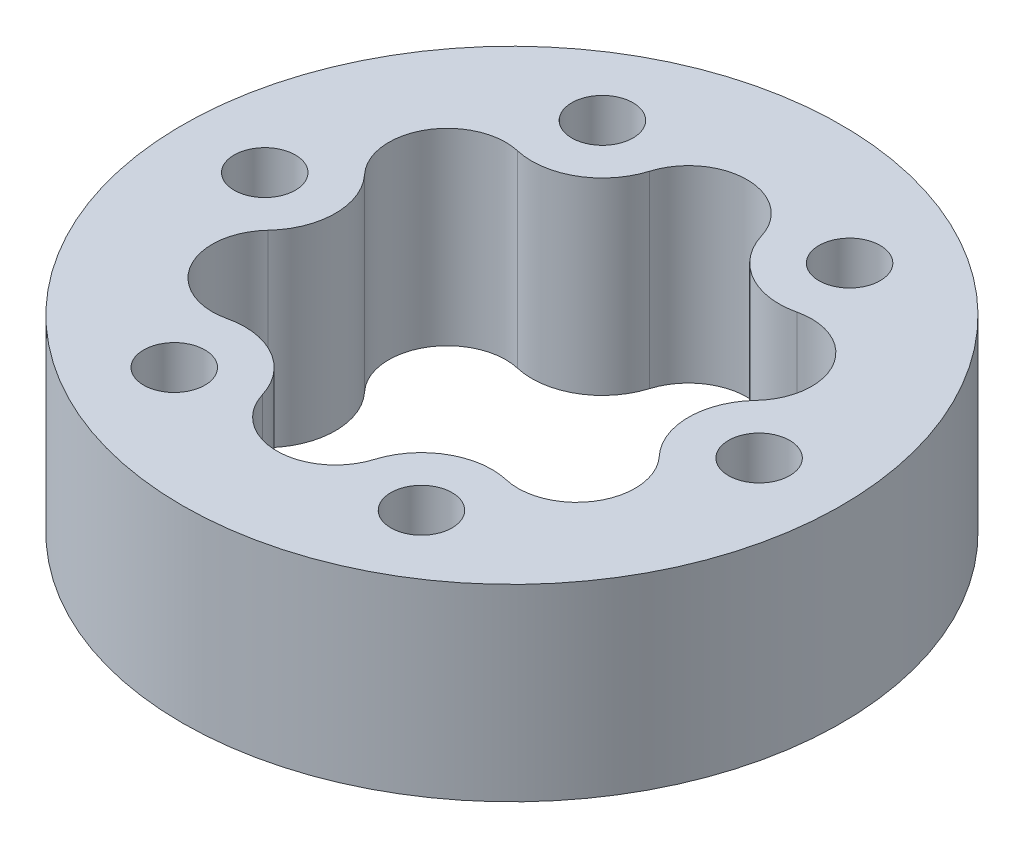
from build123d import *

# Parameters (mm, degrees)
SKETCH_1_R               = 28
SKETCH_1_R_2             = 2.6
EXTRUDE_1_DEPTH          = 16
CUT_EXTRUDE_2_DEPTH      = 43.708313008
CUT_EXTRUDE_2_DEPTH_BACK = 43.708313008


with BuildPart() as part:
    # 草图1 → 凸台-拉伸1 (new body)
    with BuildSketch(Plane(origin=(0, 0, 0), x_dir=(1, 0, 0), z_dir=(0, 1, 0))):
        with Locations(Location((0, 0, 0), (0, 0, 270))):
            Circle(SKETCH_1_R)
        with Locations(Location((10.5, 18.186533479, 0), (0, 0, 270))):
            Circle(SKETCH_1_R_2, mode=Mode.SUBTRACT)
        with Locations(Location((21, 0, 0), (0, 0, 270))):
            Circle(SKETCH_1_R_2, mode=Mode.SUBTRACT)
        with Locations(Location((10.5, -18.186533479, 0), (0, 0, 270))):
            Circle(SKETCH_1_R_2, mode=Mode.SUBTRACT)
        with Locations(Location((-10.5, -18.186533479, 0), (0, 0, 270))):
            Circle(SKETCH_1_R_2, mode=Mode.SUBTRACT)
        with Locations(Location((-21, 0, 0), (0, 0, 270))):
            Circle(SKETCH_1_R_2, mode=Mode.SUBTRACT)
        with Locations(Location((-10.5, 18.186533479, 0), (0, 0, 270))):
            Circle(SKETCH_1_R_2, mode=Mode.SUBTRACT)
    extrude(amount=EXTRUDE_1_DEPTH)

    # 草图4 → 切除-拉伸2 (cut, two sides: drawn at the far end of the back side and taken through both)
    with BuildSketch(Plane(origin=(0, 16, 0), x_dir=(1, 0, 0), z_dir=(0, 1, 0)).offset(-CUT_EXTRUDE_2_DEPTH_BACK)):
        with BuildLine():
            ThreePointArc((4.758569662, 16.444127766), (7.500000636, 12.99038069), (11.861748987, 12.343106429))
            ThreePointArc((11.861748987, 12.343106429), (17.297017892, 9.986437089), (16.620317219, 4.10102167))
            ThreePointArc((16.620317219, 4.10102167), (15, -7.34e-07), (16.620318223, -4.101022742))
            ThreePointArc((16.620318223, -4.101022742), (17.297017158, -9.98643836), (11.861747557, -12.343106096))
            ThreePointArc((11.861747557, -12.343106096), (7.499999364, -12.990381424), (4.758569235, -16.444129171))
            ThreePointArc((4.758569235, -16.444129171), (-7.34e-07, -19.972875449), (-4.758569662, -16.444127766))
            ThreePointArc((-4.758569662, -16.444127766), (-7.500000636, -12.99038069), (-11.861748987, -12.343106429))
            ThreePointArc((-11.861748987, -12.343106429), (-17.297017892, -9.986437089), (-16.620317219, -4.10102167))
            ThreePointArc((-16.620317219, -4.10102167), (-15, 7.34e-07), (-16.620318223, 4.101022742))
            ThreePointArc((-16.620318223, 4.101022742), (-17.297017158, 9.98643836), (-11.861747557, 12.343106096))
            ThreePointArc((-11.861747557, 12.343106096), (-7.499999364, 12.990381424), (-4.758569235, 16.444129171))
            ThreePointArc((-4.758569235, 16.444129171), (7.34e-07, 19.972875449), (4.758569662, 16.444127766))
        make_face()
    extrude(amount=CUT_EXTRUDE_2_DEPTH + CUT_EXTRUDE_2_DEPTH_BACK, mode=Mode.SUBTRACT)


solid = part.part
